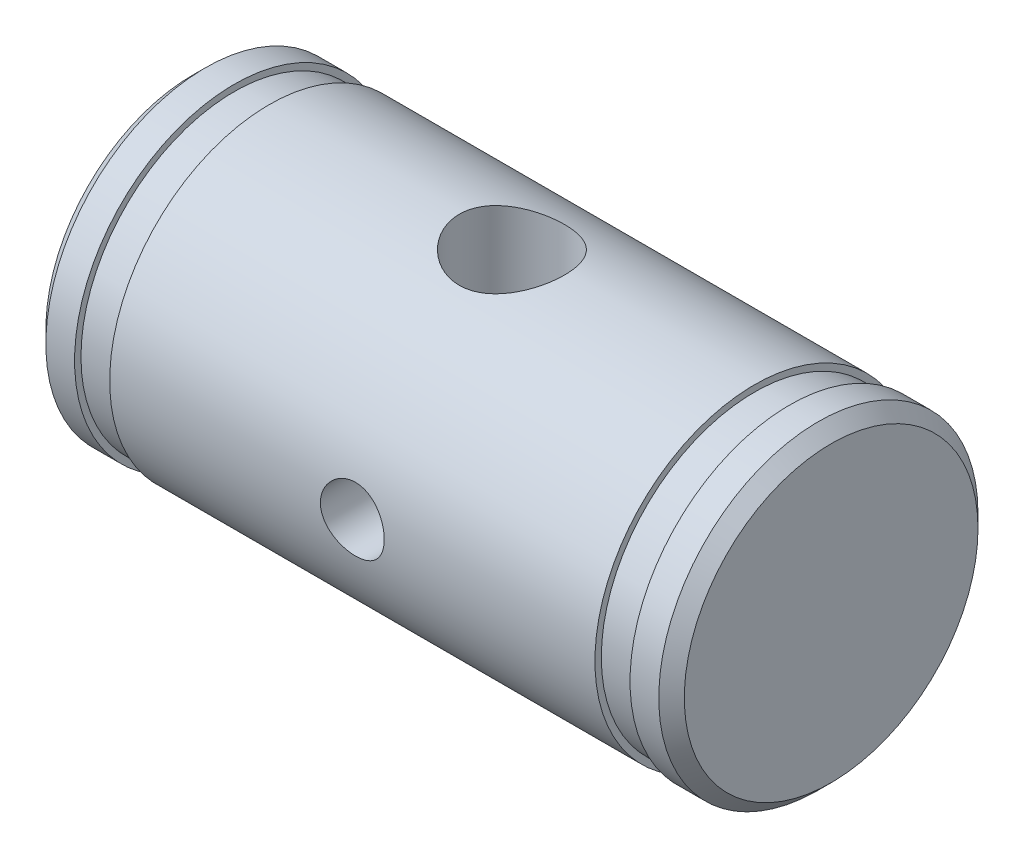
from build123d import *

# Parameters (mm, degrees)
SKETCH1_R           = 5
BOSS_EXTRUDE1_DEPTH = 10
SKETCH2_W           = 1.1
SKETCH2_H           = 0.2
CHAMFER1_SIZE       = 0.4
M4_TAPPED_HOLE4_D   = 3.3
SKETCH6_R           = 1
CUT_EXTRUDE1_DEPTH  = 16.0000001


with BuildPart() as part:
    # Sketch1 → Boss-Extrude1 (new, symmetric)
    with BuildSketch(Plane(origin=(0, 0, 0), x_dir=(0, 0, -1), z_dir=(1, 0, 0))):
        Circle(SKETCH1_R)
    extrude(amount=BOSS_EXTRUDE1_DEPTH, both=True)

    # Sketch2 → Cut-Revolve1 (revolve, cut)
    with BuildSketch(Plane(origin=(0, 0, 0), x_dir=(1, 0, 0), z_dir=(0, 1, 0))):
        with Locations((-8.15, 4.9)):
            Rectangle(SKETCH2_W, SKETCH2_H)
    cut_revolve1 = revolve(axis=Axis((0, 0, 0), (-1, 0, 0)), mode=Mode.SUBTRACT)

    # Mirror1: Cut-Revolve1 across plane
    add(cut_revolve1.mirror(Plane(origin=(0, 0, 0), x_dir=(0, 0, 1), z_dir=(1, 0, 0))), mode=Mode.SUBTRACT)

    # Chamfer1
    chamfer1_edges = [part.edges().sort_by_distance(p)[0] for p in [
        (-10, 0, 5),
        (10, 0, 5),
    ]]
    chamfer(chamfer1_edges, length=CHAMFER1_SIZE)

    # M4 Tapped Hole4 (through all)
    with Locations(Plane(origin=(0, 5, 0), x_dir=(1, 0, 0), z_dir=(0, 1, 0))):
        with Locations((0, 0)):
            Hole(M4_TAPPED_HOLE4_D / 2)

    # Sketch6 → Cut-Extrude1 (cut, through all)
    with BuildSketch(Plane(origin=(0, 0, -5), x_dir=(-1, 0, 0), z_dir=(0, 0, -1))):
        Circle(SKETCH6_R)
    extrude(amount=-CUT_EXTRUDE1_DEPTH, mode=Mode.SUBTRACT)


solid = part.part
